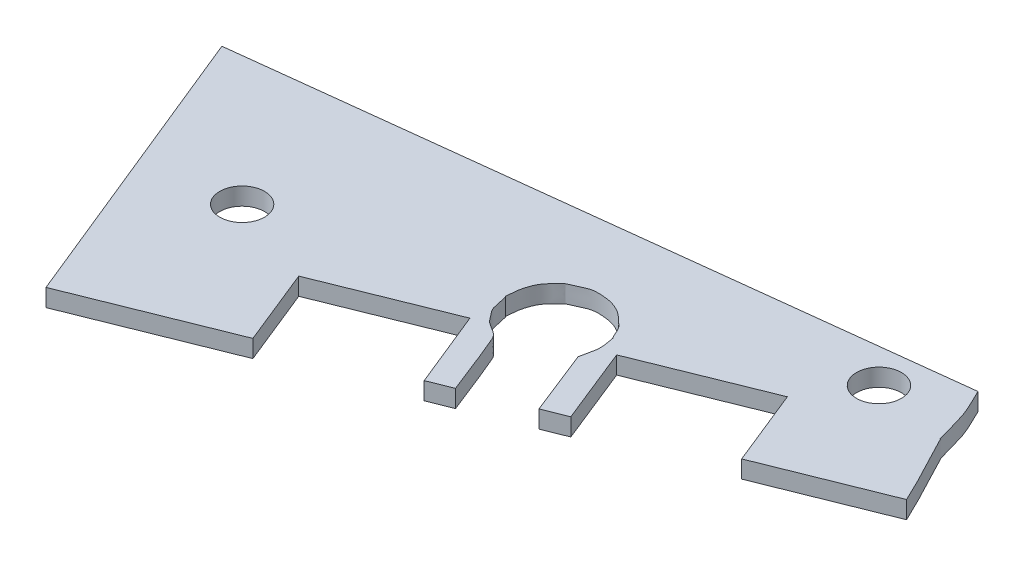
from build123d import *

# Parameters (mm, degrees)
SKETCH1_R           = 1.281558591
SKETCH1_R_2         = 1.27912149
BOSS_EXTRUDE1_DEPTH = 1.19
CUT_EXTRUDE1_DEPTH  = 2.54
CUT_EXTRUDE2_DEPTH  = 2.54
CUT_EXTRUDE4_DEPTH  = 19.812


with BuildPart() as part:
    # Sketch1 → Boss-Extrude1 (new body)
    with BuildSketch(Plane(origin=(0, 0, 0), x_dir=(1, 0, 0), z_dir=(0, 1, 0))):
        with BuildLine():
            Line((-3.948168159, 25.857752235), (34.708440024, 30.372559307))
            add(Edge.make_bspline(
                [(34.708440024, 30.372559307), (34.942308086, 29.862573914), (35.216465801, 29.369202379), (35.41004421, 28.842603127), (35.634944676, 28.230797202), (35.768879722, 27.589205916), (35.960617271, 26.966210393), (35.965938184, 26.948921629), (35.991057299, 26.944232956), (35.999261802, 26.928111554), (36.743885485, 25.464966639), (37.564180772, 24.036910168), (38.217825185, 22.530919978), (38.865327395, 21.039081363), (40.441376905, 16.960362547), (41.306486039, 14.494420913)],
                knots=[0, 0, 0, 0, 1, 1, 1, 2, 2, 2, 3, 3, 3, 4, 4, 4, 5, 5, 5, 5], degree=3))
            Line((41.306486039, 14.494420913), (26.379308433, 8.556241677))
            Line((26.379308433, 8.556241677), (21.571141955, 20.672821201))
            add(Edge.make_bspline(
                [(21.571141955, 20.672821201), (21.634910972, 21.018173468), (21.748594484, 21.35796102), (21.762449005, 21.708878001), (21.774151999, 22.005299603), (21.695806289, 22.298709609), (21.646885264, 22.591300552), (21.643902496, 22.609140136), (21.617478501, 22.613950002), (21.608496587, 22.629649458), (21.454882222, 22.898151457), (21.383454938, 23.23493464), (21.147653492, 23.435155456), (20.905488639, 23.64077949), (20.692579942, 23.888331524), (20.418328284, 24.048678297), (20.15986613, 24.199793417), (19.870796872, 24.315401802), (19.574055785, 24.355191149), (19.180278137, 24.407991911), (18.74328259, 24.448836406), (18.384663016, 24.277837116), (18.13147516, 24.157110455), (17.87065401, 24.052846943), (17.617466154, 23.932120282), (17.601139945, 23.924335514), (17.591549832, 23.906868519), (17.579117247, 23.893731605), (17.361458227, 23.66374179), (17.104351703, 23.465224478), (16.927205729, 23.202755302), (16.779704543, 22.984209467), (16.687302856, 22.728685321), (16.62063322, 22.473589178), (16.545622255, 22.186576842), (16.544200548, 21.885227936), (16.505984212, 21.591047315)],
                knots=[0, 0, 0, 0, 1, 1, 1, 2, 2, 2, 3, 3, 3, 4, 4, 4, 5, 5, 5, 6, 6, 6, 7, 7, 7, 8, 8, 8, 9, 9, 9, 10, 10, 10, 11, 11, 11, 12, 12, 12, 12], degree=3))
            add(Edge.make_bspline(
                [(16.505984212, 21.591047315), (16.518782353, 21.578266264), (16.539801332, 21.570202619), (16.544378636, 21.552704162), (16.617400623, 21.273550308), (16.663764579, 20.987872856), (16.736786566, 20.708719002), (16.806805853, 20.441044093), (17.044044502, 20.24849863), (17.19767347, 20.018388445), (17.465578341, 19.617112304), (18.031163484, 19.577799481), (18.234246012, 19.098229697), (19.127510948, 16.988826809), (19.346682772, 16.331345691), (20.002158395, 14.686998305), (21.518894597, 10.882064728), (22.011547535, 9.986611514), (22.99992287, 7.207084206)],
                knots=[0, 0, 0, 0, 1, 1, 1, 2, 2, 2, 3, 3, 3, 4, 4, 4, 5, 5, 5, 6, 6, 6, 6], degree=3))
            Line((22.99992287, 7.207084206), (6.371709484, 0.524718752))
            Line((6.371709484, 0.524718752), (-3.948168159, 25.857752235))
        make_face()
        with Locations(Location((31.581994118, 27.844041808, 0), (0, 0, 270))):
            Circle(SKETCH1_R, mode=Mode.SUBTRACT)
        with Locations(Location((4.443945521, 18.622159212, 0), (0, 0, 270))):
            Circle(SKETCH1_R_2, mode=Mode.SUBTRACT)
        Polygon((29.528011628, 24.668032897), (31.295389474, 20.292362952), (24.334912298, 17.497443293), (22.582661714, 21.866014987), align=None, mode=Mode.SUBTRACT)
        Polygon((16.577782643, 19.493154262), (18.362295388, 15.097963812), (11.376540447, 12.313291502), (9.611482192, 16.686576517), align=None, mode=Mode.SUBTRACT)
        Polygon((32.786623967, 19.298845197), (34.559807218, 14.90935059), (26.647925888, 11.722355727), (24.882600183, 16.153609635), align=None, mode=Mode.SUBTRACT)
        Polygon((18.898363139, 13.77263465), (20.661300607, 9.324417197), (12.759882633, 6.178035225), (10.974286829, 10.601867258), align=None, mode=Mode.SUBTRACT)
    extrude(amount=BOSS_EXTRUDE1_DEPTH)

    # Sketch2 → Cut-Extrude1 (cut)
    with BuildSketch(Plane.XZ):
        Polygon((2.121899542, -8.57799934), (39.66647999, -23.653702249), (44.433050533, -11.783019186), (5.975875867, 3.659128071), align=None)
    extrude(amount=-CUT_EXTRUDE1_DEPTH, mode=Mode.SUBTRACT)

    # Sketch3 → Cut-Extrude2 (cut)
    with BuildSketch(Plane.XZ):
        Polygon((10.934529699, -13.408461578), (11.662916216, -11.603738231), (18.17813327, -14.957173631), (16.698896735, -15.19986357), align=None)
    extrude(amount=-CUT_EXTRUDE2_DEPTH, mode=Mode.SUBTRACT)

    # Sketch4 → Cut-Extrude4 (cut)
    with BuildSketch(Plane(origin=(-2.671547924, 0, -6.653231796), x_dir=(0.9279826374451727, 0, -0.37262343538792764), z_dir=(0.37262343538792764, 0, 0.9279826374451727))):
        Polygon((43.841671476, 0.19), (5.068559246, 0.19), (5.594495495, -1.041479788), (45.248806257, -1.861509503), align=None)
    extrude(amount=-CUT_EXTRUDE4_DEPTH, mode=Mode.SUBTRACT)


solid = part.part
